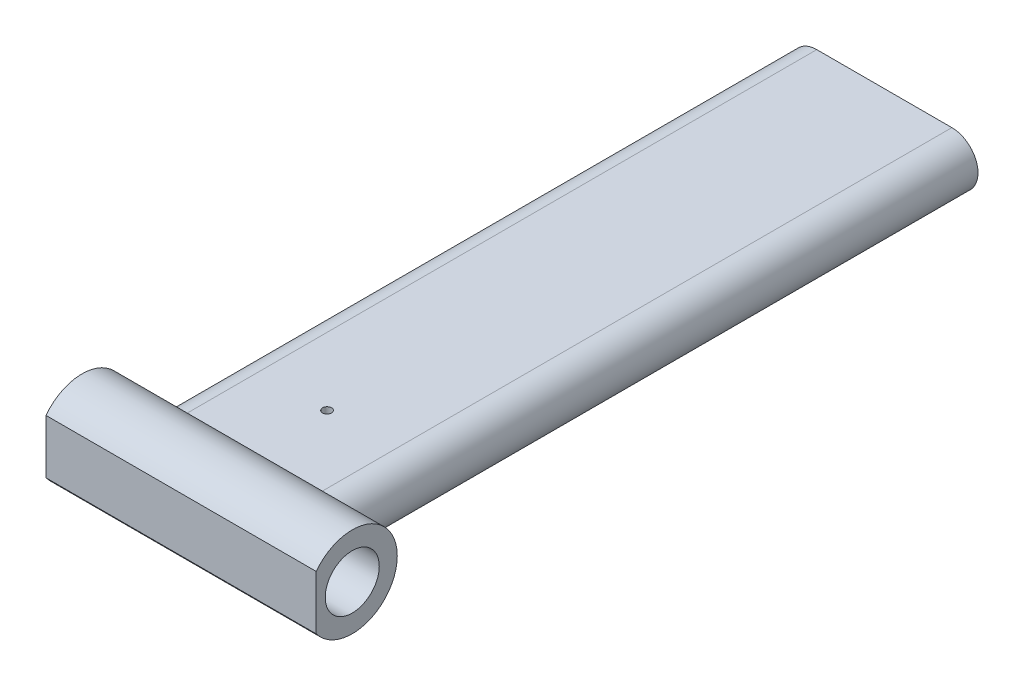
from build123d import *

# Parameters (mm, degrees)
BOSS_EXTRUDE1_DEPTH = 35
SKETCH9_R           = 5
BOSS_EXTRUDE3_DEPTH = 15
SKETCH10_W          = 39.744762059
SKETCH10_H          = 6.949903748
CUT_EXTRUDE1_DEPTH  = 13
SKETCH11_R          = 0.5
CUT_EXTRUDE2_DEPTH  = 47.286707872
SKETCH12_R          = 3
CUT_EXTRUDE3_DEPTH  = 53.72991015


with BuildPart() as part:
    # Sketch4 → Boss-Extrude1 (new, symmetric)
    with BuildSketch(Plane.XY):
        with BuildLine():
            Line((7.5, -2.9), (-7.5, -2.9))
            ThreePointArc((-7.5, -2.9), (-10.4, 0), (-7.5, 2.9))
            Line((-7.5, 2.9), (7.5, 2.9))
            ThreePointArc((7.5, 2.9), (10.4, 0), (7.5, -2.9))
        make_face()
        with BuildLine():
            Line((7.5, -1.9), (-7.5, -1.9))
            ThreePointArc((-7.5, -1.9), (-9.4, 0), (-7.5, 1.9))
            Line((-7.5, 1.9), (7.5, 1.9))
            ThreePointArc((7.5, 1.9), (9.4, 0), (7.5, -1.9))
        make_face(mode=Mode.SUBTRACT)
    extrude(amount=BOSS_EXTRUDE1_DEPTH, both=True)

    # Sketch9 → Boss-Extrude3 (add, symmetric)
    with BuildSketch(Plane(origin=(0, 0, 0), x_dir=(0, 0, -1), z_dir=(1, 0, 0))):
        with Locations((-39.073082371, 0.015275052)):
            Circle(SKETCH9_R)
    extrude(amount=BOSS_EXTRUDE3_DEPTH, both=True)

    # Sketch10 → Cut-Extrude1 (cut, symmetric)
    with BuildSketch(Plane(origin=(0, 0, 0), x_dir=(1, 0, 0), z_dir=(0, 1, 0))):
        with Locations((-2.189570447, -46.548034245)):
            Rectangle(SKETCH10_W, SKETCH10_H)
    extrude(amount=CUT_EXTRUDE1_DEPTH, both=True, mode=Mode.SUBTRACT)

    # Sketch11 → Cut-Extrude2 (cut, through all)
    with BuildSketch(Plane(origin=(0, 2.9, 0), x_dir=(1, 0, 0), z_dir=(0, 1, 0))):
        with Locations(Location((0, -26.870162273, 0), (0, 0, 180))):
            Circle(SKETCH11_R)
    extrude(amount=-CUT_EXTRUDE2_DEPTH, mode=Mode.SUBTRACT)

    # Sketch12 → Cut-Extrude3 (cut, through all)
    with BuildSketch(Plane(origin=(15, 0, 0), x_dir=(0, 0, -1), z_dir=(1, 0, 0))):
        with Locations((-39.073082371, 0.015275052)):
            Circle(SKETCH12_R)
    extrude(amount=-CUT_EXTRUDE3_DEPTH, mode=Mode.SUBTRACT)


solid = part.part
